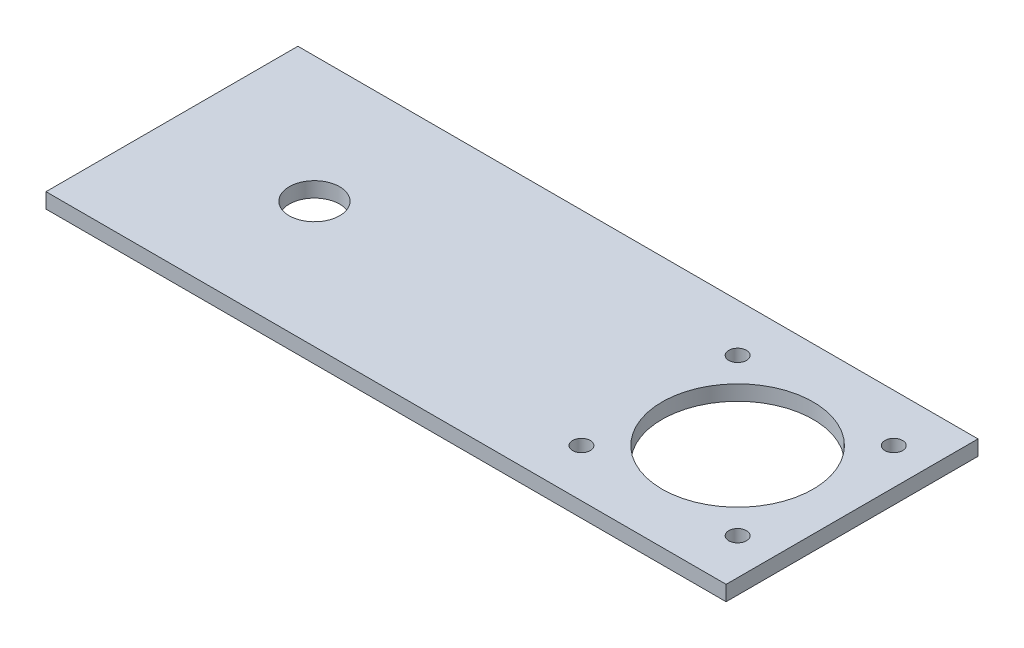
from build123d import *

# Parameters (mm, degrees)
SKETCH1_W           = 135
SKETCH1_H           = 50
SKETCH1_R           = 5
SKETCH1_R_2         = 15
SKETCH1_R_3         = 1.75
BOSS_EXTRUDE1_DEPTH = 3


with BuildPart() as part:
    # Sketch1 → Boss-Extrude1 (new body)
    with BuildSketch(Plane(origin=(0, 0, 0), x_dir=(1, 0, 0), z_dir=(0, 1, 0))):
        with Locations((67.5, 25)):
            Rectangle(SKETCH1_W, SKETCH1_H)
        with Locations(Location((28.284271247, 25, 0), (0, 0, 270))):
            Circle(SKETCH1_R, mode=Mode.SUBTRACT)
        with Locations(Location((112.284271247, 25, 0), (0, 0, 270))):
            Circle(SKETCH1_R_2, mode=Mode.SUBTRACT)
        with Locations(Location((96.784271247, 40.5, 0), (0, 0, 270))):
            Circle(SKETCH1_R_3, mode=Mode.SUBTRACT)
        with Locations(Location((96.784271247, 9.5, 0), (0, 0, 270))):
            Circle(SKETCH1_R_3, mode=Mode.SUBTRACT)
        with Locations(Location((127.784271247, 9.5, 0), (0, 0, 270))):
            Circle(SKETCH1_R_3, mode=Mode.SUBTRACT)
        with Locations(Location((127.784271247, 40.5, 0), (0, 0, 270))):
            Circle(SKETCH1_R_3, mode=Mode.SUBTRACT)
    extrude(amount=BOSS_EXTRUDE1_DEPTH)


solid = part.part
